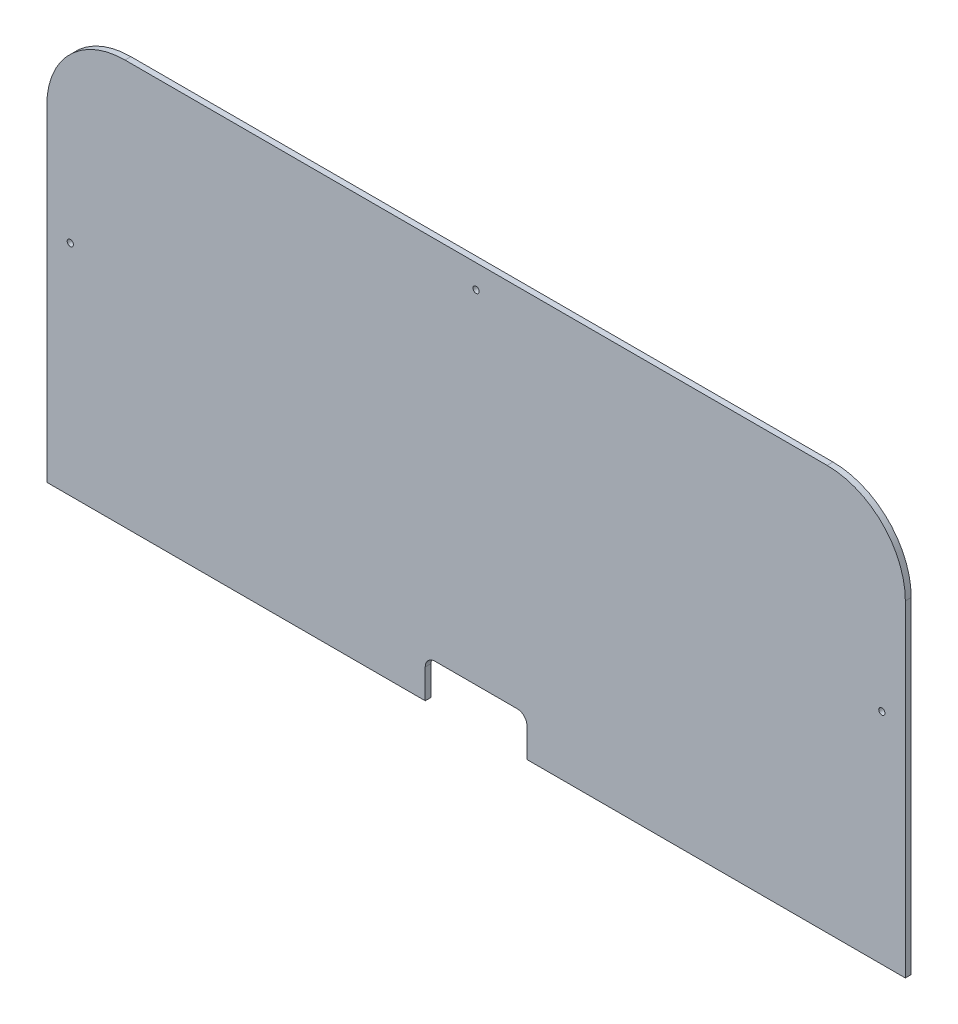
from build123d import *

# Parameters (mm, degrees)
SKETCH1_W           = 439
SKETCH1_H           = 207
BOSS_EXTRUDE1_DEPTH = 3
FILLET1_R           = 40
CUT_EXTRUDE1_DEPTH  = 243.696312292
SKETCH3_R           = 1.6
CUT_EXTRUDE2_DEPTH  = 243.696312292
SKETCH4_R           = 1.6
CUT_EXTRUDE3_DEPTH  = 243.696312292


with BuildPart() as part:
    # Sketch1 → Boss-Extrude1 (new body)
    with BuildSketch(Plane.XY):
        Rectangle(SKETCH1_W, SKETCH1_H)
    extrude(amount=BOSS_EXTRUDE1_DEPTH)

    # Fillet1
    fillet1_edges = [part.edges().sort_by_distance(p)[0] for p in [
        (-219.5, 103.5, 1.5),
        (219.5, 103.5, 1.5),
    ]]
    fillet(fillet1_edges, radius=FILLET1_R)

    # Sketch2 → Cut-Extrude1 (cut, through all)
    with BuildSketch(Plane(origin=(0, 0, 0), x_dir=(-1, 0, 0), z_dir=(0, 0, -1))):
        with BuildLine():
            Line((-21, -83.5), (21, -83.5))
            ThreePointArc((21, -83.5), (24.535533906, -84.964466094), (26, -88.5))
            Line((26, -88.5), (26, -103.5))
            Line((26, -103.5), (-26, -103.5))
            Line((-26, -103.5), (-26, -88.5))
            ThreePointArc((-26, -88.5), (-24.535533906, -84.964466094), (-21, -83.5))
        make_face()
    extrude(amount=-CUT_EXTRUDE1_DEPTH, mode=Mode.SUBTRACT)

    # Sketch3 → Cut-Extrude2 (cut, through all)
    with BuildSketch(Plane.XY.offset(3)):
        with Locations((-207.5, 8.5)):
            Circle(SKETCH3_R)
        with Locations((207.5, 8.5)):
            Circle(SKETCH3_R)
    extrude(amount=-CUT_EXTRUDE2_DEPTH, mode=Mode.SUBTRACT)

    # Sketch4 → Cut-Extrude3 (cut, through all)
    with BuildSketch(Plane.XY.offset(3)):
        with Locations((0, 91.5)):
            Circle(SKETCH4_R)
    extrude(amount=-CUT_EXTRUDE3_DEPTH, mode=Mode.SUBTRACT)


solid = part.part
